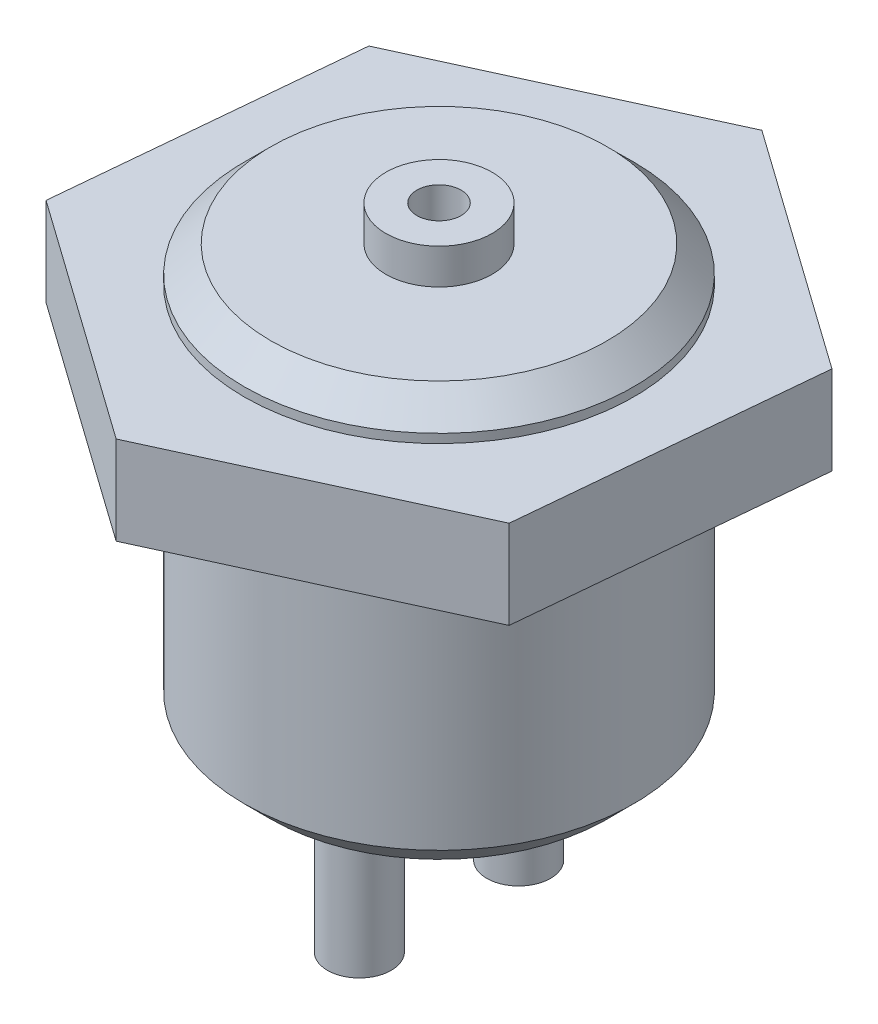
from build123d import *

# Parameters (mm, degrees)
SKETCH_1_R             = 11
EXTRUDE_1_DEPTH        = 23.4
SKETCH_2_R             = 3
EXTRUDE_2_DEPTH        = 2
HOLE_WIZARD_M3_1_D     = 2.5
HOLE_WIZARD_M3_1_DEPTH = 7.5
HOLE_WIZARD_M3_1_TIP   = 0.751075774
CHAMFER_1_SIZE         = 1.5
CHAMFER_2_SIZE         = 1.5
SKETCH_5_R             = 1.8
EXTRUDE_3_DEPTH        = 9
EXTRUDE_4_DEPTH        = 5


with BuildPart() as part:
    # 草图1 → 凸台-拉伸1 (new body)
    with BuildSketch(Plane(origin=(0, 0, 0), x_dir=(1, 0, 0), z_dir=(0, 1, 0))):
        with Locations(Location((0, 0, 0), (0, 0, 270))):
            Circle(SKETCH_1_R)
    extrude(amount=EXTRUDE_1_DEPTH)

    # 草图2 → 凸台-拉伸2 (add)
    with BuildSketch(Plane(origin=(0, 23.4, 0), x_dir=(1, 0, 0), z_dir=(0, 1, 0))):
        with Locations(Location((0, 0, 0), (0, 0, 270))):
            Circle(SKETCH_2_R)
    extrude(amount=EXTRUDE_2_DEPTH)

    # M3 螺纹孔1
    with Locations(Plane(origin=(0, 25.4, 0), x_dir=(-1, 0, 0), z_dir=(0, 1, 0))):
        with Locations((0, 0)):
            Hole(HOLE_WIZARD_M3_1_D / 2, depth=HOLE_WIZARD_M3_1_DEPTH)
            with Locations((0, 0, -(HOLE_WIZARD_M3_1_DEPTH + HOLE_WIZARD_M3_1_TIP / 2))):  # 118° drill point
                Cone(0, HOLE_WIZARD_M3_1_D / 2, HOLE_WIZARD_M3_1_TIP, mode=Mode.SUBTRACT)

    # 倒角1
    chamfer_1_edges = [part.edges().sort_by_distance(p)[0] for p in [
        (0, 23.4, -11),
    ]]
    chamfer(chamfer_1_edges, length=CHAMFER_1_SIZE)

    # 倒角2
    chamfer_2_edges = [part.edges().sort_by_distance(p)[0] for p in [
        (0, 0, -11),
    ]]
    chamfer(chamfer_2_edges, length=CHAMFER_2_SIZE)

    # 草图5 → 凸台-拉伸3 (add)
    with BuildSketch(Plane.XZ):
        with Locations(Location((0, 4.5, 0), (0, 0, 90))):
            Circle(SKETCH_5_R)
        with Locations(Location((0, -4.5, 0), (0, 0, 90))):
            Circle(SKETCH_5_R)
    extrude(amount=EXTRUDE_3_DEPTH)

    # 草图6 → 凸台-拉伸4 (add)
    with BuildSketch(Plane(origin=(0, 16.4, 0), x_dir=(-1, 0, 0), z_dir=(0, 1, 0))):
        Polygon((13.652715142, -9.69209485), (15.219957927, 6.977550719), (1.567242785, 16.669645569), (-13.652715142, 9.69209485), (-15.219957927, -6.977550719), (-1.567242785, -16.669645569), align=None)
    extrude(amount=EXTRUDE_4_DEPTH)


solid = part.part
